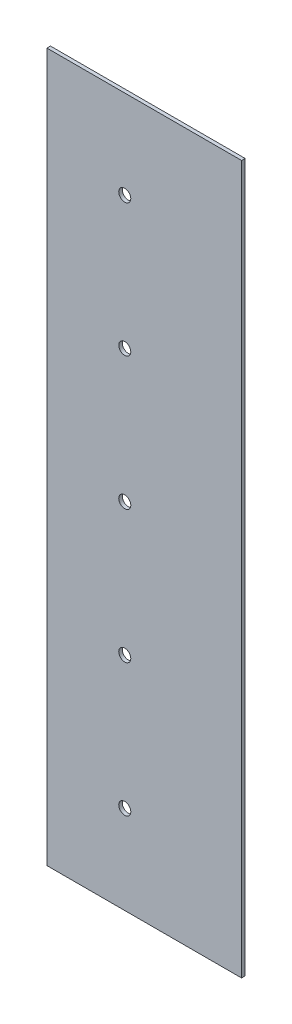
from build123d import *

# Parameters (mm, degrees)
SKETCH_1_W            = 55
SKETCH_1_H            = 200
EXTRUDE_1_DEPTH       = 1
HOLE_WIZARD_M31_D     = 3.4
HOLE_WIZARD_M31_DEPTH = 5
HOLE_WIZARD_M31_TIP   = 1.021463052


with BuildPart() as part:
    # Эскиз1 → Бобышка-Вытянуть1 (new body)
    with BuildSketch(Plane.XY):
        with Locations((27.5, 100)):
            Rectangle(SKETCH_1_W, SKETCH_1_H)
    extrude(amount=EXTRUDE_1_DEPTH)

    # Отверстие с зазором M31
    with Locations(Plane(origin=(0, 0, 0), x_dir=(-1, 0, 0), z_dir=(0, 0, -1))):
        with Locations((-22, 175), (-22, 137.5), (-22, 100), (-22, 62.5), (-22, 25)):
            Hole(HOLE_WIZARD_M31_D / 2, depth=HOLE_WIZARD_M31_DEPTH)
            with Locations((0, 0, -(HOLE_WIZARD_M31_DEPTH + HOLE_WIZARD_M31_TIP / 2))):  # 118° drill point
                Cone(0, HOLE_WIZARD_M31_D / 2, HOLE_WIZARD_M31_TIP, mode=Mode.SUBTRACT)


solid = part.part
